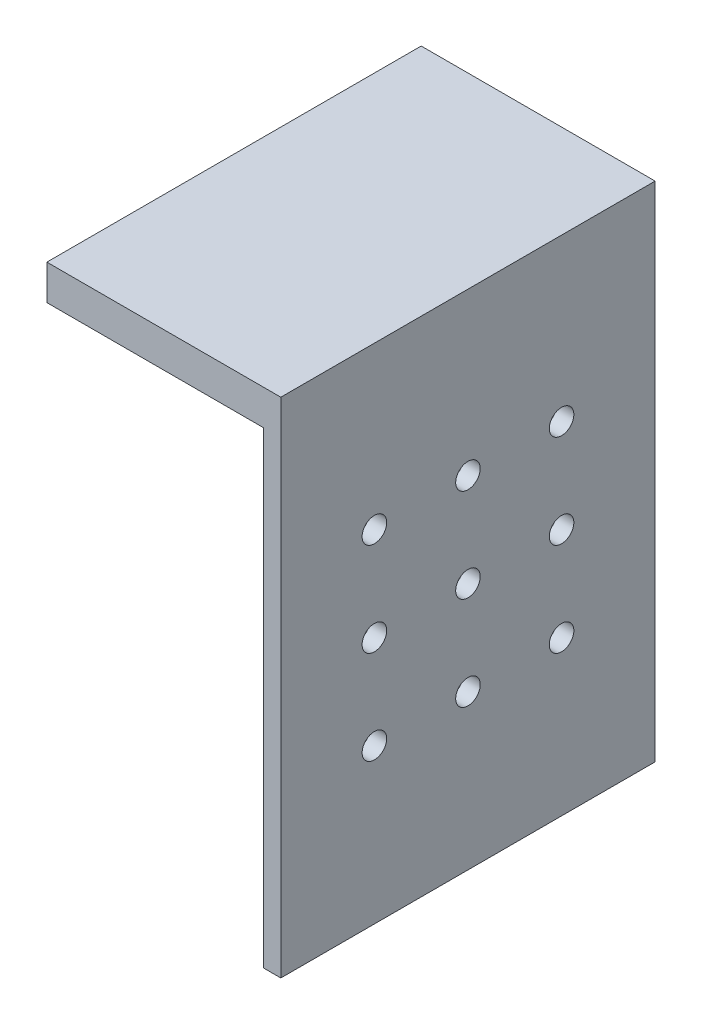
from build123d import *

# Parameters (mm, degrees)
SKETCH_1_W          = 15
SKETCH_1_H          = 40
EXTRUDE_1_DEPTH     = 32
SKETCH_3_W          = 15
SKETCH_3_H          = 32
EXTRUDE_2_DEPTH     = 10
SKETCH_5_W          = 13
SKETCH_5_H          = 45
CUT_EXTRUDE_1_DEPTH = 62.229078059
SKETCH_7_W          = 32
SKETCH_7_H          = 50
EXTRUDE_3_DEPTH     = 5
SKETCH_8_W          = 3
SKETCH_8_H          = 40
CUT_EXTRUDE_2_DEPTH = 63.641839053
SKETCH_9_W          = 3
SKETCH_9_H          = 5
CUT_EXTRUDE_3_DEPTH = 63.641839053
SKETCH_10_R         = 1.5
EXTRUDE_4_DEPTH     = 5
SKETCH_11_R         = 1.05
CUT_EXTRUDE_4_DEPTH = 63.641839053
SKETCH_12_W         = 4
SKETCH_12_H         = 5
CUT_EXTRUDE_5_DEPTH = 63.641839053
SKETCH_13_W         = 2.538060983
SKETCH_13_H         = 40
CUT_EXTRUDE_6_DEPTH = 63.641839053
SKETCH_14_W         = 20
SKETCH_14_H         = 2
CUT_EXTRUDE_7_DEPTH = 63.641839053


with BuildPart() as part:
    # 草图1 → 凸台-拉伸1 (new body)
    with BuildSketch(Plane.XY):
        with Locations((7.5, 20)):
            Rectangle(SKETCH_1_W, SKETCH_1_H)
    extrude(amount=EXTRUDE_1_DEPTH)

    # 草图3 → 凸台-拉伸2 (add)
    with BuildSketch(Plane(origin=(0, 40, 0), x_dir=(1, 0, 0), z_dir=(0, 1, 0))):
        with Locations((7.5, -16)):
            Rectangle(SKETCH_3_W, SKETCH_3_H)
    extrude(amount=EXTRUDE_2_DEPTH)

    # 草图5 → 切除-拉伸1 (cut, through all)
    with BuildSketch(Plane.XY.offset(32)):
        with Locations((6.5, 22.5)):
            Rectangle(SKETCH_5_W, SKETCH_5_H)
    extrude(amount=-CUT_EXTRUDE_1_DEPTH, mode=Mode.SUBTRACT)

    # 草图7 → 凸台-拉伸3 (add)
    with BuildSketch(Plane(origin=(15, 0, 0), x_dir=(0, 0, -1), z_dir=(1, 0, 0))):
        with Locations((-16, 25)):
            Rectangle(SKETCH_7_W, SKETCH_7_H)
    extrude(amount=EXTRUDE_3_DEPTH)

    # 草图8 → 切除-拉伸2 (cut, through all)
    with BuildSketch(Plane.XY.offset(32)):
        with Locations((14.5, 25)):
            Rectangle(SKETCH_8_W, SKETCH_8_H)
    extrude(amount=-CUT_EXTRUDE_2_DEPTH, mode=Mode.SUBTRACT)

    # 草图9 → 切除-拉伸3 (cut, through all)
    with BuildSketch(Plane.XY.offset(32)):
        with Locations((14.5, 2.5)):
            Rectangle(SKETCH_9_W, SKETCH_9_H)
    extrude(amount=-CUT_EXTRUDE_3_DEPTH, mode=Mode.SUBTRACT)

    # 草图10 → 凸台-拉伸4 (add)
    with BuildSketch(Plane.XZ.offset(-45)):
        with Locations(Location((3, 16, 0), (0, 0, 90))):
            Circle(SKETCH_10_R)
    extrude(amount=EXTRUDE_4_DEPTH)

    # 草图11 → 切除-拉伸4 (cut, through all)
    with BuildSketch(Plane(origin=(20, 0, 0), x_dir=(0, 0, -1), z_dir=(1, 0, 0))):
        with Locations((-24, 34.2)):
            Circle(SKETCH_11_R)
        with Locations((-24, 26.2)):
            Circle(SKETCH_11_R)
        with Locations((-24, 18.2)):
            Circle(SKETCH_11_R)
        with Locations((-16, 34.2)):
            Circle(SKETCH_11_R)
        with Locations((-16, 26.2)):
            Circle(SKETCH_11_R)
        with Locations((-16, 18.2)):
            Circle(SKETCH_11_R)
        with Locations((-8, 18.2)):
            Circle(SKETCH_11_R)
        with Locations((-8, 26.2)):
            Circle(SKETCH_11_R)
        with Locations((-8, 34.2)):
            Circle(SKETCH_11_R)
    extrude(amount=-CUT_EXTRUDE_4_DEPTH, mode=Mode.SUBTRACT)

    # 草图12 → 切除-拉伸5 (cut, through all)
    with BuildSketch(Plane.XY.offset(32)):
        with Locations((18, 2.5)):
            Rectangle(SKETCH_12_W, SKETCH_12_H)
    extrude(amount=-CUT_EXTRUDE_5_DEPTH, mode=Mode.SUBTRACT)

    # 草图13 → 切除-拉伸6 (cut, through all)
    with BuildSketch(Plane.XY.offset(32)):
        with Locations((17.269030492, 25)):
            Rectangle(SKETCH_13_W, SKETCH_13_H)
    extrude(amount=-CUT_EXTRUDE_6_DEPTH, mode=Mode.SUBTRACT)

    # 草图14 → 切除-拉伸7 (cut, through all)
    with BuildSketch(Plane.XY.offset(32)):
        with Locations((10, 49)):
            Rectangle(SKETCH_14_W, SKETCH_14_H)
    extrude(amount=-CUT_EXTRUDE_7_DEPTH, mode=Mode.SUBTRACT)


solid = part.part
